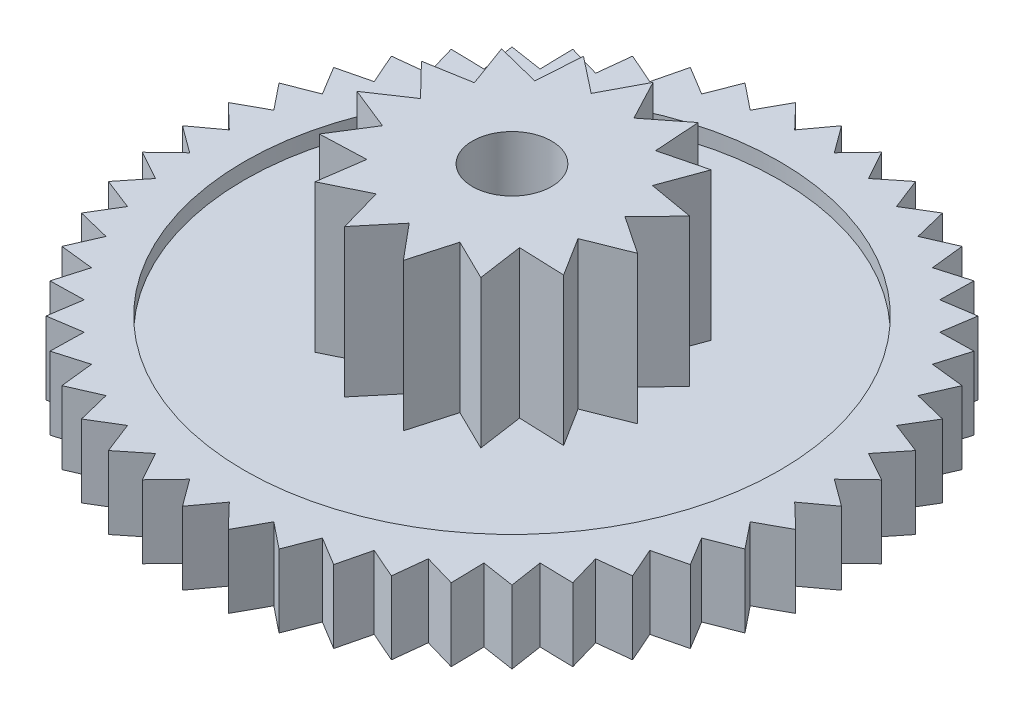
from build123d import *

# Parameters (mm, degrees)
SKETCH2_R          = 7.25
CUT_EXTRUDE1_DEPTH = 10.185586535
SKETCH3_R          = 3.175
CUT_EXTRUDE3_DEPTH = 2.8
SKETCH4_R          = 0.75
CUT_EXTRUDE4_DEPTH = 10.652947736


with BuildPart() as part:
    # Sketch1 → Revolve1 (revolve)
    with BuildSketch(Plane.XY, mode=Mode.PRIVATE) as revolve1_sk:
        Polygon((0, 3.88), (0, 0), (1.67, 0), (1.67, 0.3), (5.075, 0.3), (5.075, 0), (6.25, 0), (6.25, 1.38), (5.075, 1.38), (5.075, 1.08), (2.675, 1.08), (2.675, 3.88), align=None)
    revolve(revolve1_sk.sketch.rotate(Axis((0, 3.88, 0), (0, -1, 0)), 90), axis=Axis((0, 3.88, 0), (0, -1, 0)))

    # Sketch2 → Cut-Extrude1 (cut, through all)
    with BuildSketch(Plane(origin=(0, 1.38, 0), x_dir=(1, 0, 0), z_dir=(0, 1, 0))):
        Circle(SKETCH2_R)
        Polygon((-0.376067993, 5.737688809), (0, 6.25), (0.376067993, 5.737688809), (0.815788701, 6.196530384), (1.121769352, 5.639515362), (1.617619032, 6.037036414), (1.848276925, 5.444848245), (2.391771452, 5.774247078), (2.543159969, 5.157018264), (3.125, 5.412658774), (3.19452884, 4.780950271), (3.804758931, 4.958458377), (3.791238437, 4.323078893), (4.419417382, 4.419417382), (4.323078893, 3.791238437), (4.958458377, 3.804758931), (4.780950271, 3.19452884), (5.412658774, 3.125), (5.157018264, 2.543159969), (5.774247078, 2.391771452), (5.444848245, 1.848276925), (6.037036414, 1.617619032), (5.639515362, 1.121769352), (6.196530384, 0.815788701), (5.737688809, 0.376067993), (6.25, 0), (5.737688809, -0.376067993), (6.196530384, -0.815788701), (5.639515362, -1.121769352), (6.037036414, -1.617619032), (5.444848245, -1.848276925), (5.774247078, -2.391771452), (5.157018264, -2.543159969), (5.412658774, -3.125), (4.780950271, -3.19452884), (4.958458377, -3.804758931), (4.323078893, -3.791238437), (4.419417382, -4.419417382), (3.791238437, -4.323078893), (3.804758931, -4.958458377), (3.19452884, -4.780950271), (3.125, -5.412658774), (2.543159969, -5.157018264), (2.391771452, -5.774247078), (1.848276925, -5.444848245), (1.617619032, -6.037036414), (1.121769352, -5.639515362), (0.815788701, -6.196530384), (0.376067993, -5.737688809), (0, -6.25), (-0.376067993, -5.737688809), (-0.815788701, -6.196530384), (-1.121769352, -5.639515362), (-1.617619032, -6.037036414), (-1.848276925, -5.444848245), (-2.391771452, -5.774247078), (-2.543159969, -5.157018264), (-3.125, -5.412658774), (-3.19452884, -4.780950271), (-3.804758931, -4.958458377), (-3.791238437, -4.323078893), (-4.419417382, -4.419417382), (-4.323078893, -3.791238437), (-4.958458377, -3.804758931), (-4.780950271, -3.19452884), (-5.412658774, -3.125), (-5.157018264, -2.543159969), (-5.774247078, -2.391771452), (-5.444848245, -1.848276925), (-6.037036414, -1.617619032), (-5.639515362, -1.121769352), (-6.196530384, -0.815788701), (-5.737688809, -0.376067993), (-6.25, 0), (-5.737688809, 0.376067993), (-6.196530384, 0.815788701), (-5.639515362, 1.121769352), (-6.037036414, 1.617619032), (-5.444848245, 1.848276925), (-5.774247078, 2.391771452), (-5.157018264, 2.543159969), (-5.412658774, 3.125), (-4.780950271, 3.19452884), (-4.958458377, 3.804758931), (-4.323078893, 3.791238437), (-4.419417382, 4.419417382), (-3.791238437, 4.323078893), (-3.804758931, 4.958458377), (-3.19452884, 4.780950271), (-3.125, 5.412658774), (-2.543159969, 5.157018264), (-2.391771452, 5.774247078), (-1.848276925, 5.444848245), (-1.617619032, 6.037036414), (-1.121769352, 5.639515362), (-0.815788701, 6.196530384), align=None, mode=Mode.SUBTRACT)
    extrude(amount=-CUT_EXTRUDE1_DEPTH, mode=Mode.SUBTRACT)

    # Sketch3 → Cut-Extrude3 (cut)
    with BuildSketch(Plane(origin=(0, 3.88, 0), x_dir=(1, 0, 0), z_dir=(0, 1, 0))):
        Circle(SKETCH3_R)
        Polygon((0, 2.675), (-0.405427797, 1.907387821), (-1.08802052, 2.443734099), (-1.146181242, 1.577583139), (-1.987912408, 1.789924372), (-1.688749537, 0.975), (-2.544076181, 0.82662046), (-1.939317696, 0.203830503), (-2.66034607, -0.279613639), (-1.854560207, -0.602583139), (-2.316617955, -1.3375), (-1.44913241, -1.304804682), (-1.57232555, -2.16412046), (-0.793136454, -1.781413642), (-0.556163773, -2.616544832), (0, -1.95), (0.556163773, -2.616544832), (0.793136454, -1.781413642), (1.57232555, -2.16412046), (1.44913241, -1.304804682), (2.316617955, -1.3375), (1.854560207, -0.602583139), (2.66034607, -0.279613639), (1.939317696, 0.203830503), (2.544076181, 0.82662046), (1.688749537, 0.975), (1.987912408, 1.789924372), (1.146181242, 1.577583139), (1.08802052, 2.443734099), (0.405427797, 1.907387821), align=None, mode=Mode.SUBTRACT)
    extrude(amount=-CUT_EXTRUDE3_DEPTH, mode=Mode.SUBTRACT)

    # Sketch4 → Cut-Extrude4 (cut, through all)
    with BuildSketch(Plane(origin=(0, 3.88, 0), x_dir=(1, 0, 0), z_dir=(0, 1, 0))):
        with Locations(Location((0, 0, 0), (0, 0, 270))):
            Circle(SKETCH4_R)
    extrude(amount=-CUT_EXTRUDE4_DEPTH, mode=Mode.SUBTRACT)


solid = part.part
